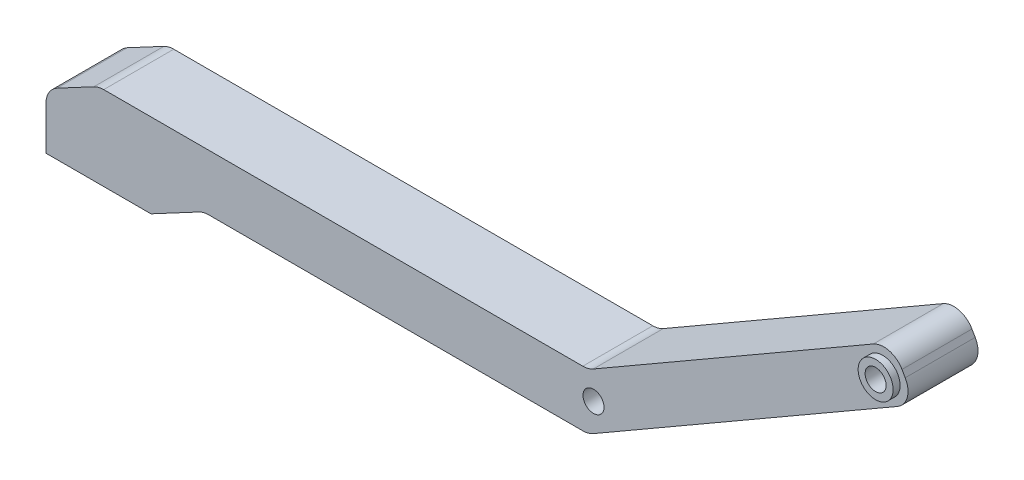
from build123d import *

# Parameters (mm, degrees)
SKETCH_1_R      = 1.5
EXTRUDE_1_DEPTH = 10
FILLET_1_R      = 3
SKETCH_2_R      = 2.5
SKETCH_2_R_2    = 1.5
EXTRUDE_2_DEPTH = 1


with BuildPart() as part:
    # 草图1 → 凸台-拉伸1 (new body)
    with BuildSketch(Plane.XY):
        Polygon((-7.5, 4), (-7.5, -4), (7.5, -4), (15, 0), (70, 0), (116.765371804, 27), (113.301270189, 33), (70, 8), (0, 8), align=None)
        with Locations((112.0368731, 28.27)):
            Circle(SKETCH_1_R, mode=Mode.SUBTRACT)
        with Locations((70.727461339, 4.42)):
            Circle(SKETCH_1_R, mode=Mode.SUBTRACT)
    extrude(amount=EXTRUDE_1_DEPTH)

    # 圆角1
    fillet_1_edges = [part.edges().sort_by_distance(p)[0] for p in [
        (-7.5, 4, 5),
        (0, 8, 5),
        (70, 8, 5),
        (113.301270189, 33, 5),
        (116.765371804, 27, 5),
        (70, 0, 5),
        (15, 0, 5),
    ]]
    fillet(fillet_1_edges, radius=FILLET_1_R)

    # 草图2 → 凸台-拉伸2 (add)
    with BuildSketch(Plane.XY.offset(10)):
        with Locations((112.0368731, 28.27)):
            Circle(SKETCH_2_R)
        with Locations((112.0368731, 28.27)):
            Circle(SKETCH_2_R_2, mode=Mode.SUBTRACT)
    extrude(amount=EXTRUDE_2_DEPTH)


solid = part.part
